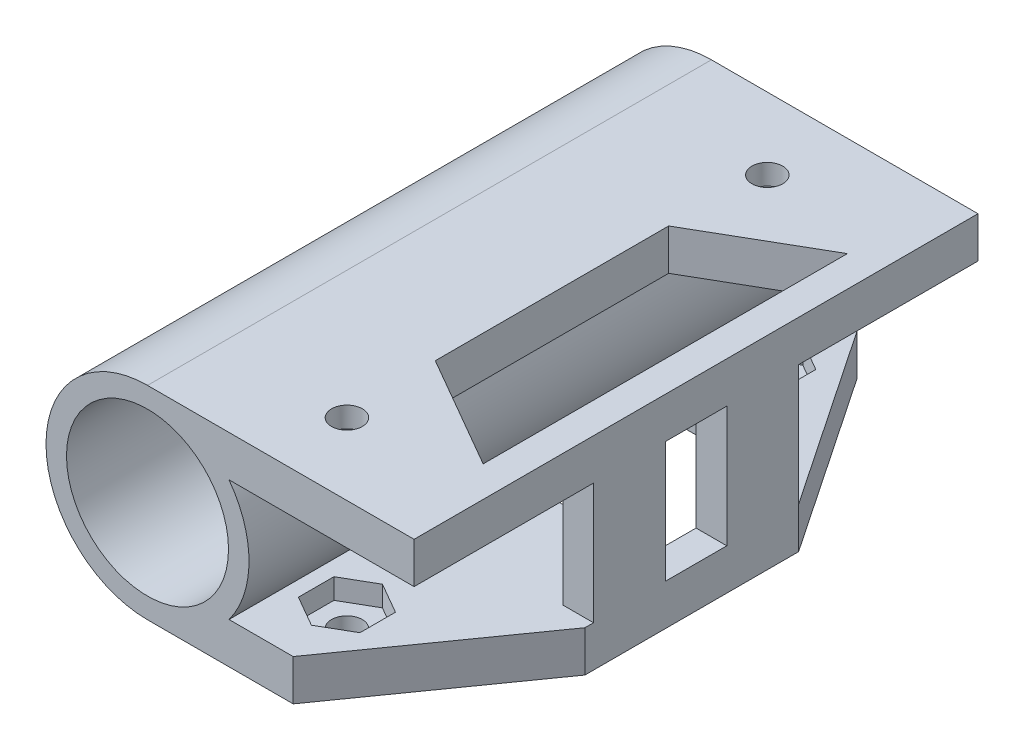
from build123d import *

# Parameters (mm, degrees)
EXTRUDE_1_DEPTH      = 48
EXTRUDE_1_DEPTH_BACK = 7
SKETCH_2_R           = 9.9
SKETCH_2_R_2         = 7.9
CUT_EXTRUDE_1_DEPTH  = 2
SKETCH_4_R           = 1.5
CUT_EXTRUDE_2_DEPTH  = 28
CUT_EXTRUDE_3_DEPTH  = 10
SKETCH_7_W           = 3
SKETCH_7_H           = 7
EXTRUDE_3_DEPTH      = 12
CUT_EXTRUDE_4_DEPTH  = 10
CUT_EXTRUDE_START    = 11.8
CUT_EXTRUDE_7_DEPTH  = 2


with BuildPart() as part:
    # Эскиз2 → Бобышка-Вытянуть1 (new, two sides: drawn at the far end of the back side and taken through both)
    # profile 1 of 3: a face of its own
    with BuildSketch(Plane.XY.offset(-EXTRUDE_1_DEPTH_BACK)):
        Circle(SKETCH_2_R)
        Circle(SKETCH_2_R_2, mode=Mode.SUBTRACT)
    # profile 2 of 3: a face of its own
    with BuildSketch(Plane.XY.offset(-EXTRUDE_1_DEPTH_BACK)):
        with BuildLine():
            Line((26, 9.9), (0, 9.9))
            ThreePointArc((0, 9.9), (4.449719092, 8.843641784), (7.949842766, 5.9))
            Line((7.949842766, 5.9), (26, 5.9))
            Line((26, 5.9), (26, 9.9))
        make_face()
    # profile 3 of 3: a face of its own
    with BuildSketch(Plane.XY.offset(-EXTRUDE_1_DEPTH_BACK)):
        with BuildLine():
            ThreePointArc((7.949842766, -5.9), (4.449719092, -8.843641784), (0, -9.9))
            Line((0, -9.9), (26, -9.9))
            Line((26, -9.9), (26, -5.9))
            Line((26, -5.9), (7.949842766, -5.9))
        make_face()
    extrude(amount=EXTRUDE_1_DEPTH + EXTRUDE_1_DEPTH_BACK)

    # Эскиз3 → Вырез-Вытянуть1 (cut)
    with BuildSketch(Plane.XZ.offset(-5.9)):
        Polygon((15.449842766, -1.732050808), (15.449842766, 1.732050808), (12.449842766, 3.464101615), (9.449842766, 1.732050808), (9.449842766, -1.732050808), (12.449842766, -3.464101615), align=None)
        Polygon((12.449842766, 44.464101615), (15.449842766, 42.732050808), (15.449842766, 39.267949192), (12.449842766, 37.535898385), (9.449842766, 39.267949192), (9.449842766, 42.732050808), align=None)
    extrude(amount=-CUT_EXTRUDE_1_DEPTH, mode=Mode.SUBTRACT)

    # Эскиз4 → Вырез-Вытянуть2 (cut)
    with BuildSketch(Plane(origin=(0, 9.9, 0), x_dir=(1, 0, 0), z_dir=(0, 1, 0))):
        with Locations(Location((12.449842766, 0, 0), (0, 0, 270))):
            Circle(SKETCH_4_R)
        with Locations(Location((12.449842766, -41, 0), (0, 0, 270))):
            Circle(SKETCH_4_R)
    extrude(amount=-CUT_EXTRUDE_2_DEPTH, mode=Mode.SUBTRACT)

    # Эскиз5 → Вырез-Вытянуть3 (cut)
    with BuildSketch(Plane(origin=(0, 9.9, 0), x_dir=(1, 0, 0), z_dir=(0, 1, 0))):
        Polygon((23, -38.261238623), (23, -2.738761377), (11.949842766, -9.118572631), (11.949842766, -31.881427369), align=None)
    extrude(amount=-CUT_EXTRUDE_3_DEPTH, mode=Mode.SUBTRACT)

    # Эскиз7 → Бобышка-Вытянуть3 (add)
    with BuildSketch(Plane.XZ.offset(-5.9)):
        with Locations((24.5, 14)):
            Rectangle(SKETCH_7_W, SKETCH_7_H)
        with Locations((24.5, 27)):
            Rectangle(SKETCH_7_W, SKETCH_7_H)
    extrude(amount=EXTRUDE_3_DEPTH)

    # Эскиз8 → Вырез-Вытянуть4 (cut)
    with BuildSketch(Plane.XZ.offset(9.9)):
        Polygon((26, -7), (26, 10.5), (14.207826174, -7), align=None)
        Polygon((26, 48), (26, 31.334606818), (14.207826174, 48), align=None)
        Polygon((23, 22), (9.923665741, 22), (9.923665741, 5.63795963), (18.975811945, 5.63795963), (23, 11.609995999), align=None)
    extrude(amount=-CUT_EXTRUDE_4_DEPTH, mode=Mode.SUBTRACT)

    # Эскиз3<2> → Вырез-Вытянуть7 (cut)
    with BuildSketch(Plane.XZ.offset(-5.9).offset(CUT_EXTRUDE_START)):
        Polygon((15.449842766, 42.732050808), (15.449842766, 39.267949192), (12.449842766, 37.535898385), (9.449842766, 39.267949192), (9.449842766, 42.732050808), (12.449842766, 44.464101615), align=None)
        Polygon((9.449842766, -1.732050808), (12.449842766, -3.464101615), (15.449842766, -1.732050808), (15.449842766, 1.732050808), (12.449842766, 3.464101615), (9.449842766, 1.732050808), align=None)
    extrude(amount=CUT_EXTRUDE_7_DEPTH, mode=Mode.SUBTRACT)


solid = part.part
